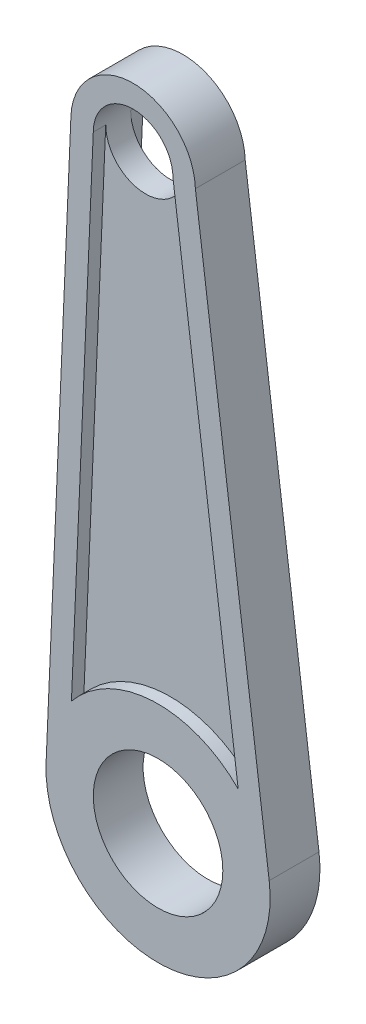
from build123d import *
from build123d.topology import SkipClean

# Parameters (mm, degrees)
SKETCH1_R           = 13
BOSS_EXTRUDE1_DEPTH = 10
BOSS_EXTRUDE2_DEPTH = 2.5


with BuildPart() as part:
    # Sketch1 → Boss-Extrude1 (new body)
    with BuildSketch(Plane.XY):
        with BuildLine():
            ThreePointArc((12.493571176, 52.175265389), (0.070557662, 64.274218072), (-12.488249851, 52.316280347))
            Line((-12.488249851, 52.316280347), (-17.476763734, -62.653355789))
            ThreePointArc((-17.476763734, -62.653355789), (5.982333293, -86.1073463), (27.31069915, -60.700266301))
            Line((27.31069915, -60.700266301), (12.493571176, 52.175265389))
        make_face()
        with Locations((5.002085998, -63.628709437)):
            Circle(SKETCH1_R, mode=Mode.SUBTRACT)
        with BuildLine():
            Line((-12.387834173, -49.351431108), (-8, 51.774417209))
            ThreePointArc((-8, 51.774417209), (0, 59.774417209), (8, 51.774417209))
            Line((8, 51.774417209), (21.083150248, -47.891830059))
            ThreePointArc((21.083150248, -47.891830059), (4.021838702, -41.150072573), (-12.387834173, -49.351431108))
        make_face(mode=Mode.SUBTRACT)
    extrude(amount=BOSS_EXTRUDE1_DEPTH)

    # Sketch2 → Boss-Extrude2 (add, symmetric)
    with SkipClean():  # the faces are left unmerged after this step: merging them gives an invalid solid
        with BuildSketch(Plane.XY.offset(5)):
            with BuildLine():
                ThreePointArc((8, 51.774417209), (0, 43.774417209), (-8, 51.774417209))
                Line((-8, 51.774417209), (-12.387834173, -49.351431108))
                ThreePointArc((-12.387834173, -49.351431108), (4.021838702, -41.150072573), (21.083150248, -47.891830059))
                Line((21.083150248, -47.891830059), (8, 51.774417209))
            make_face()
        extrude(amount=BOSS_EXTRUDE2_DEPTH, both=True)


solid = part.part
